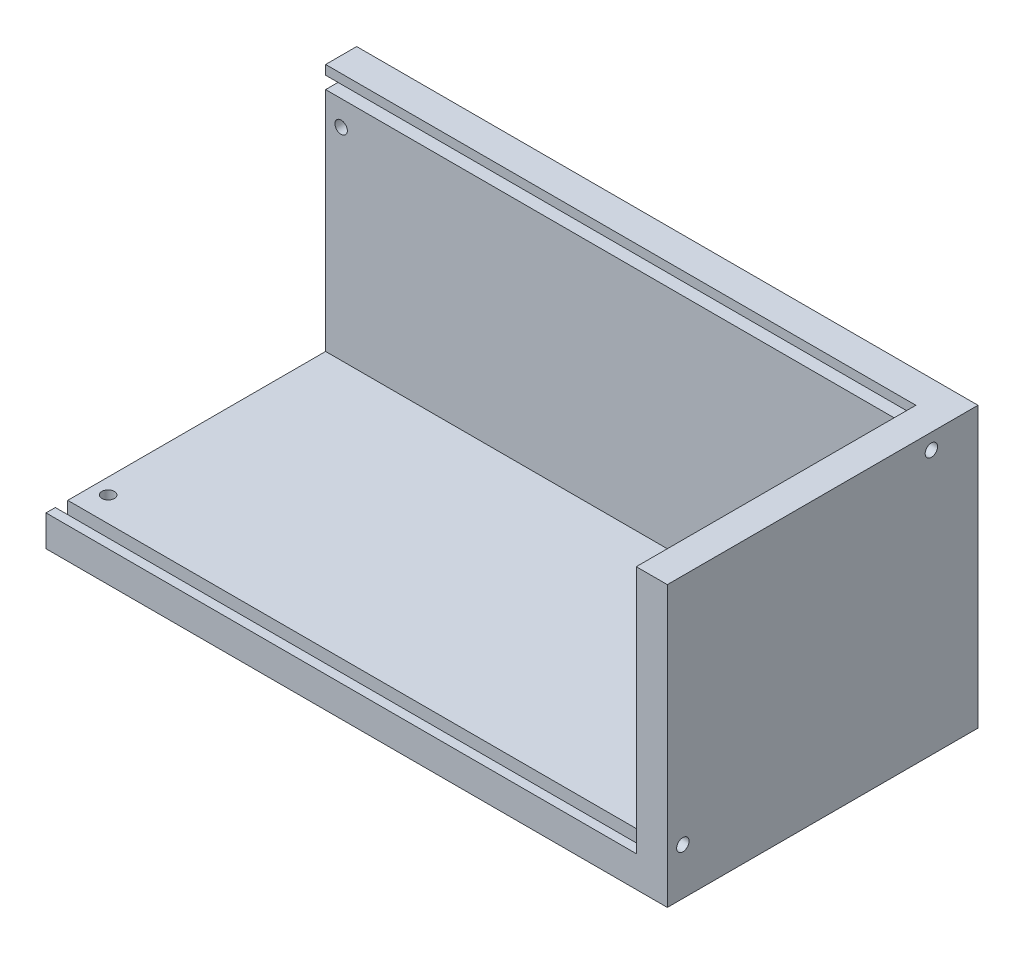
from build123d import *

# Parameters (mm, degrees)
CROQUIS1_W                                  = 100
CROQUIS1_H                                  = 50
SALIENTE_EXTRUIR1_DEPTH                     = 5
SALIENTE_EXTRUIR2_DEPTH                     = 40
CROQUIS3_W                                  = 95
CROQUIS3_H                                  = 2
CORTAR_EXTRUIR1_DEPTH                       = 2
CROQUIS4_W                                  = 95
CROQUIS4_H                                  = 2
CORTAR_EXTRUIR2_DEPTH                       = 2
DI_METRO_DE_TALADRO_2_0_2_1_D               = 2
DI_METRO_DE_TALADRO_2_0_2_2_D               = 2
DI_METRO_DE_TALADRO_2_0_2_2_DEPTH           = 10
DI_METRO_DE_TALADRO_2_0_2_2_TIP             = 0.600860619
DI_METRO_DE_TALADRO_2_0_2_2_ON_FACE_2_D     = 2
DI_METRO_DE_TALADRO_2_0_2_2_ON_FACE_2_DEPTH = 10
DI_METRO_DE_TALADRO_2_0_2_2_ON_FACE_2_TIP   = 0.600860619


with BuildPart() as part:
    # Croquis1 → Saliente-Extruir1 (new body)
    with BuildSketch(Plane(origin=(0, 0, 0), x_dir=(1, 0, 0), z_dir=(0, 1, 0))):
        with Locations((50, 25)):
            Rectangle(CROQUIS1_W, CROQUIS1_H)
    extrude(amount=SALIENTE_EXTRUIR1_DEPTH)

    # Croquis2 → Saliente-Extruir2 (add)
    with BuildSketch(Plane(origin=(0, 5, 0), x_dir=(1, 0, 0), z_dir=(0, 1, 0))):
        Polygon((0, 45), (95, 45), (95, 0), (100, 0), (100, 50), (0, 50), align=None)
    extrude(amount=SALIENTE_EXTRUIR2_DEPTH)

    # Croquis3 → Cortar-Extruir1 (cut)
    with BuildSketch(Plane.XY.offset(-45)):
        with Locations((47.5, 42.5)):
            Rectangle(CROQUIS3_W, CROQUIS3_H)
    extrude(amount=-CORTAR_EXTRUIR1_DEPTH, mode=Mode.SUBTRACT)

    # Croquis4 → Cortar-Extruir2 (cut)
    with BuildSketch(Plane(origin=(0, 5, 0), x_dir=(1, 0, 0), z_dir=(0, 1, 0))):
        with Locations((47.5, 2.5)):
            Rectangle(CROQUIS4_W, CROQUIS4_H)
    extrude(amount=-CORTAR_EXTRUIR2_DEPTH, mode=Mode.SUBTRACT)

    # Diámetro de taladro Ø2.0 (2)1 (through all)
    with Locations(Plane(origin=(95, 42.5, -42.5), x_dir=(0, 0, -1), z_dir=(-1, 0, 0))):
        with Locations((0, 0), (-40, 35)):
            Hole(DI_METRO_DE_TALADRO_2_0_2_1_D / 2)

    # Diámetro de taladro Ø2.0 (2)2
    with Locations(Plane(origin=(2.5, 37.5, -50), x_dir=(-1, 0, 0), z_dir=(0, 0, -1))):
        with Locations((0, 0)):
            Hole(DI_METRO_DE_TALADRO_2_0_2_2_D / 2, depth=DI_METRO_DE_TALADRO_2_0_2_2_DEPTH)
            with Locations((0, 0, -(DI_METRO_DE_TALADRO_2_0_2_2_DEPTH + DI_METRO_DE_TALADRO_2_0_2_2_TIP / 2))):  # 118° drill point
                Cone(0, DI_METRO_DE_TALADRO_2_0_2_2_D / 2, DI_METRO_DE_TALADRO_2_0_2_2_TIP, mode=Mode.SUBTRACT)

    # Diámetro de taladro Ø2.0 (2)2 on face 2
    with Locations(Plane(origin=(2.5, 0, -7.5), x_dir=(0, 0, -1), z_dir=(0, -1, 0))):
        with Locations((0, 0)):
            Hole(DI_METRO_DE_TALADRO_2_0_2_2_ON_FACE_2_D / 2, depth=DI_METRO_DE_TALADRO_2_0_2_2_ON_FACE_2_DEPTH)
            with Locations((0, 0, -(DI_METRO_DE_TALADRO_2_0_2_2_ON_FACE_2_DEPTH + DI_METRO_DE_TALADRO_2_0_2_2_ON_FACE_2_TIP / 2))):  # 118° drill point
                Cone(0, DI_METRO_DE_TALADRO_2_0_2_2_ON_FACE_2_D / 2, DI_METRO_DE_TALADRO_2_0_2_2_ON_FACE_2_TIP, mode=Mode.SUBTRACT)


solid = part.part
